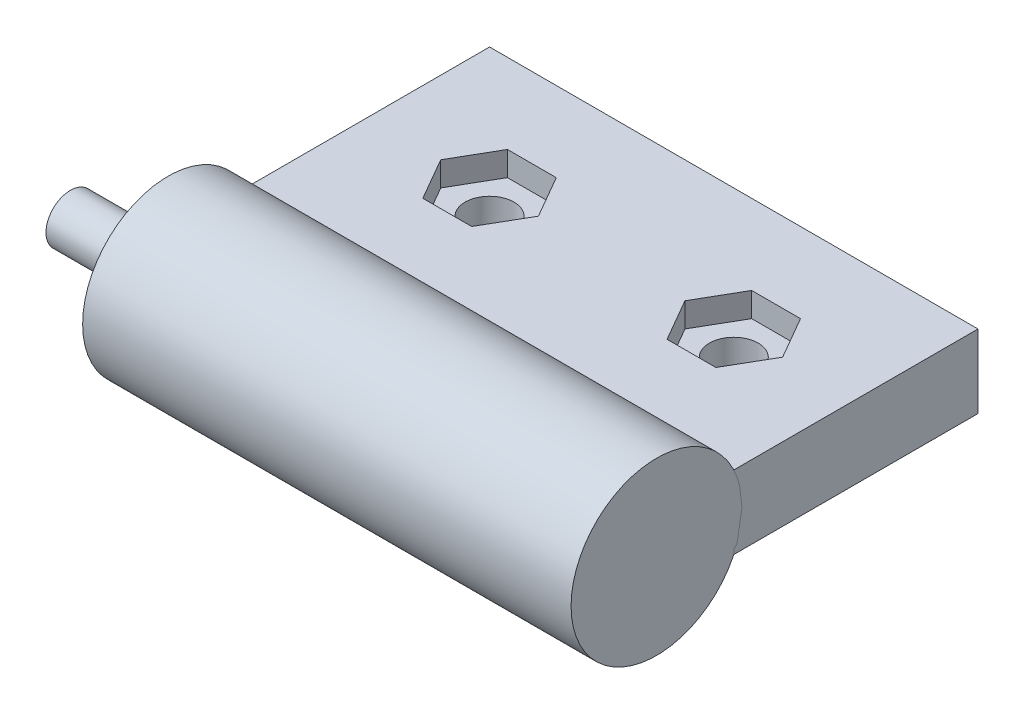
from build123d import *

# Parameters (mm, degrees)
SKETCH_1_W      = 10
SKETCH_1_H      = 5
SKETCH_1_R      = 0.5
EXTRUDE_1_DEPTH = 1
SKETCH_2_W      = 10
SKETCH_2_H      = 5
EXTRUDE_2_DEPTH = 0.5
SKETCH_3_R      = 1.75
EXTRUDE_3_DEPTH = 10
SKETCH_5_R      = 0.5
EXTRUDE_4_DEPTH = 2


with BuildPart() as part:
    # 草图1 → 凸台-拉伸1 (new body)
    with BuildSketch(Plane(origin=(0, 0, 0), x_dir=(1, 0, 0), z_dir=(0, 1, 0))):
        with Locations((5, 2.5)):
            Rectangle(SKETCH_1_W, SKETCH_1_H)
        with Locations(Location((2.5, 2.5, 0), (0, 0, 270))):
            Circle(SKETCH_1_R, mode=Mode.SUBTRACT)
        with Locations(Location((7.5, 2.5, 0), (0, 0, 270))):
            Circle(SKETCH_1_R, mode=Mode.SUBTRACT)
    extrude(amount=EXTRUDE_1_DEPTH)

    # 草图2 → 凸台-拉伸2 (add)
    with BuildSketch(Plane(origin=(0, 1, 0), x_dir=(1, 0, 0), z_dir=(0, 1, 0))):
        with Locations((5, 2.5)):
            Rectangle(SKETCH_2_W, SKETCH_2_H)
        Polygon((3, 1.633974596), (2, 1.633974596), (1.5, 2.5), (2, 3.366025404), (3, 3.366025404), (3.5, 2.5), align=None, mode=Mode.SUBTRACT)
        Polygon((7, 3.366025404), (6.5, 2.5), (7, 1.633974596), (8, 1.633974596), (8.5, 2.5), (8, 3.366025404), align=None, mode=Mode.SUBTRACT)
    extrude(amount=EXTRUDE_2_DEPTH)


with BuildPart() as body_2:
    # 草图3 → 凸台-拉伸3 (new body)
    with BuildSketch(Plane(origin=(10, 0, 0), x_dir=(0, 0, -1), z_dir=(1, 0, 0))):
        with Locations((-1.58113883, 0.75)):
            Circle(SKETCH_3_R)
    extrude(amount=-EXTRUDE_3_DEPTH)

    # 草图5 → 凸台-拉伸4 (add)
    with BuildSketch(Plane.ZY):
        with Locations((1.58113883, 0.75)):
            Circle(SKETCH_5_R)
    extrude(amount=EXTRUDE_4_DEPTH)


solid = Compound([part.part, body_2.part])
